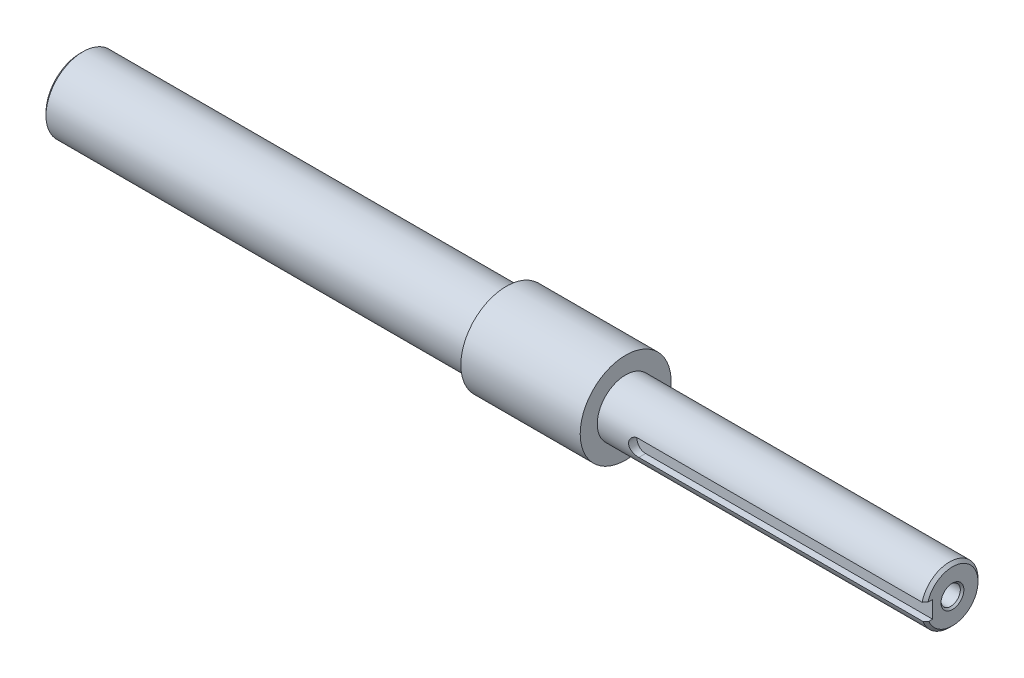
from build123d import *

# Parameters (mm, degrees)
F_5_0MM_DOWEL_HOLE1_D           = 5
F_5_0MM_DOWEL_HOLE1_DEPTH       = 15
F_5_0MM_DOWEL_HOLE1_CSINK_D     = 5.05
F_5_0MM_DOWEL_HOLE1_CSINK_ANGLE = 90
F_5_0MM_DOWEL_HOLE1_TIP         = 1.502151548
M5_TAPPED_HOLE1_D               = 4.2
M5_TAPPED_HOLE1_DEPTH           = 15
M5_TAPPED_HOLE1_CSINK_D         = 5.05
M5_TAPPED_HOLE1_CSINK_ANGLE     = 90
M5_TAPPED_HOLE1_TIP             = 1.2618073
CUT_EXTRUDE1_DEPTH              = 3
CHAMFER1_SIZE                   = 1
M8_TAPPED_HOLE1_D               = 6.8
M8_TAPPED_HOLE1_DEPTH           = 16
M8_TAPPED_HOLE1_CSINK_D         = 8.05
M8_TAPPED_HOLE1_CSINK_ANGLE     = 90
M8_TAPPED_HOLE1_TIP             = 2.042926105


with BuildPart() as part:
    # Sketch1 → Revolve1 (revolve)
    with BuildSketch(Plane.XY, mode=Mode.PRIVATE) as revolve1_sk:
        Polygon((0, 0), (0, 13), (150, 13), (150, 16), (192, 16), (192, 10), (307, 10), (307, 0), align=None)
    revolve(revolve1_sk.sketch.rotate(Axis((0, 0, 0), (1, 0, 0)), 90), axis=Axis((0, 0, 0), (1, 0, 0)))

    # Ø5.0mm Dowel Hole1
    with Locations(Plane.ZY):
        with Locations((0, 8), (0, -8)):
            CounterSinkHole(F_5_0MM_DOWEL_HOLE1_D / 2, F_5_0MM_DOWEL_HOLE1_CSINK_D / 2, depth=F_5_0MM_DOWEL_HOLE1_DEPTH, counter_sink_angle=F_5_0MM_DOWEL_HOLE1_CSINK_ANGLE)
            with Locations((0, 0, -(F_5_0MM_DOWEL_HOLE1_DEPTH + F_5_0MM_DOWEL_HOLE1_TIP / 2))):  # 118° drill point
                Cone(0, F_5_0MM_DOWEL_HOLE1_D / 2, F_5_0MM_DOWEL_HOLE1_TIP, mode=Mode.SUBTRACT)

    # M5 Tapped Hole1
    with Locations(Plane.ZY):
        with Locations((0, 0)):
            CounterSinkHole(M5_TAPPED_HOLE1_D / 2, M5_TAPPED_HOLE1_CSINK_D / 2, depth=M5_TAPPED_HOLE1_DEPTH, counter_sink_angle=M5_TAPPED_HOLE1_CSINK_ANGLE)
            with Locations((0, 0, -(M5_TAPPED_HOLE1_DEPTH + M5_TAPPED_HOLE1_TIP / 2))):  # 118° drill point
                Cone(0, M5_TAPPED_HOLE1_D / 2, M5_TAPPED_HOLE1_TIP, mode=Mode.SUBTRACT)

    # Sketch7 → Cut-Extrude1 (cut)
    with BuildSketch(Plane.XY.offset(10)):
        with BuildLine():
            Line((307, 2.528133731), (206, 2.528133731))
            ThreePointArc((206, 2.528133731), (203, -0.471866269), (206, -3.471866269))
            Line((206, -3.471866269), (307, -3.471866269))
            Line((307, -3.471866269), (307, 2.528133731))
        make_face()
    extrude(amount=-CUT_EXTRUDE1_DEPTH, mode=Mode.SUBTRACT)

    # Chamfer1
    chamfer1_edges = [part.edges().sort_by_distance(p)[0] for p in [
        (307, 0.494710277, -9.987755591),
        (0, 0, -13),
    ]]
    chamfer(chamfer1_edges, length=CHAMFER1_SIZE)

    # M8 Tapped Hole1
    with Locations(Plane(origin=(307, 0, 0), x_dir=(0, 0, -1), z_dir=(1, 0, 0))):
        with Locations((0, 0)):
            CounterSinkHole(M8_TAPPED_HOLE1_D / 2, M8_TAPPED_HOLE1_CSINK_D / 2, depth=M8_TAPPED_HOLE1_DEPTH, counter_sink_angle=M8_TAPPED_HOLE1_CSINK_ANGLE)
            with Locations((0, 0, -(M8_TAPPED_HOLE1_DEPTH + M8_TAPPED_HOLE1_TIP / 2))):  # 118° drill point
                Cone(0, M8_TAPPED_HOLE1_D / 2, M8_TAPPED_HOLE1_TIP, mode=Mode.SUBTRACT)


solid = part.part
